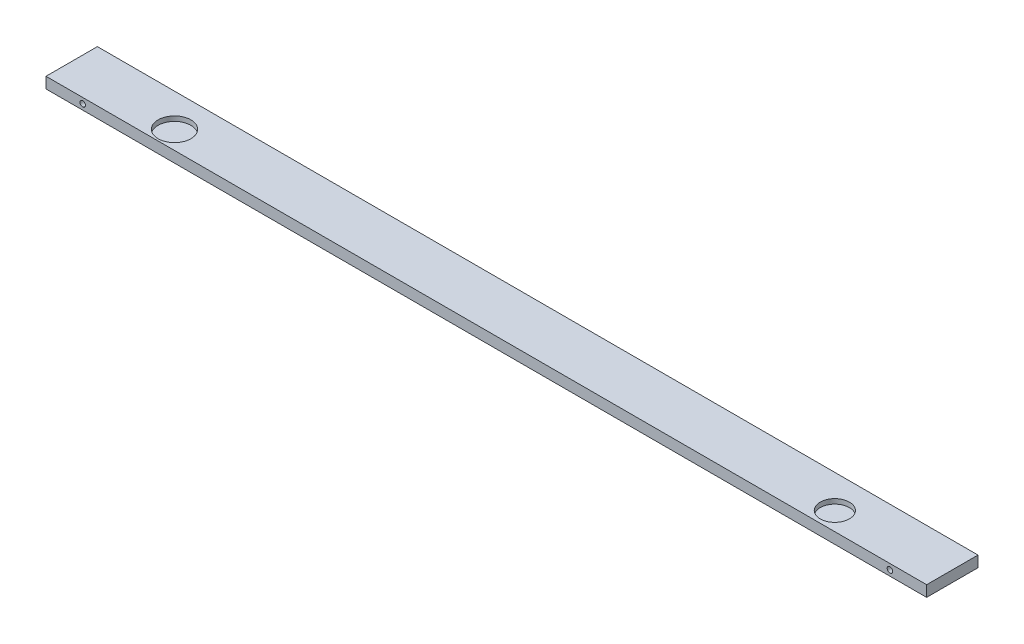
from build123d import *

# Parameters (mm, degrees)
CROQUIS1_W              = 240
CROQUIS1_H              = 14
SALIENTE_EXTRUIR2_DEPTH = 3
CROQUIS3_R              = 4.466306423
CROQUIS3_R_2            = 3.970050153
CORTAR_EXTRUIR1_DEPTH   = 1.3
CROQUIS4_R              = 0.75
CORTAR_EXTRUIR2_DEPTH   = 121.851148112


with BuildPart() as part:
    # Croquis1 → Saliente-Extruir2 (new body)
    with BuildSketch(Plane(origin=(0, 0, 0), x_dir=(1, 0, 0), z_dir=(0, 1, 0))):
        Rectangle(CROQUIS1_W, CROQUIS1_H)
    extrude(amount=SALIENTE_EXTRUIR2_DEPTH)

    # Croquis3 → Cortar-Extruir1 (cut)
    with BuildSketch(Plane(origin=(0, 3, 0), x_dir=(1, 0, 0), z_dir=(0, 1, 0))):
        with Locations(Location((-89.977775034, -2, 0), (0, 0, 270))):
            Circle(CROQUIS3_R)
        with Locations(Location((89.977775034, -2, 0), (0, 0, 270))):
            Circle(CROQUIS3_R_2)
    extrude(amount=-CORTAR_EXTRUIR1_DEPTH, mode=Mode.SUBTRACT)

    # Croquis4 → Cortar-Extruir2 (cut, through all)
    with BuildSketch(Plane(origin=(0, 0, -7), x_dir=(-1, 0, 0), z_dir=(0, 0, -1))):
        with Locations((-110, 1.5)):
            Circle(CROQUIS4_R)
        with Locations(Location((110, 1.5, 0), (0, 0, 180))):
            Circle(CROQUIS4_R)
    extrude(amount=-CORTAR_EXTRUIR2_DEPTH, mode=Mode.SUBTRACT)


solid = part.part
